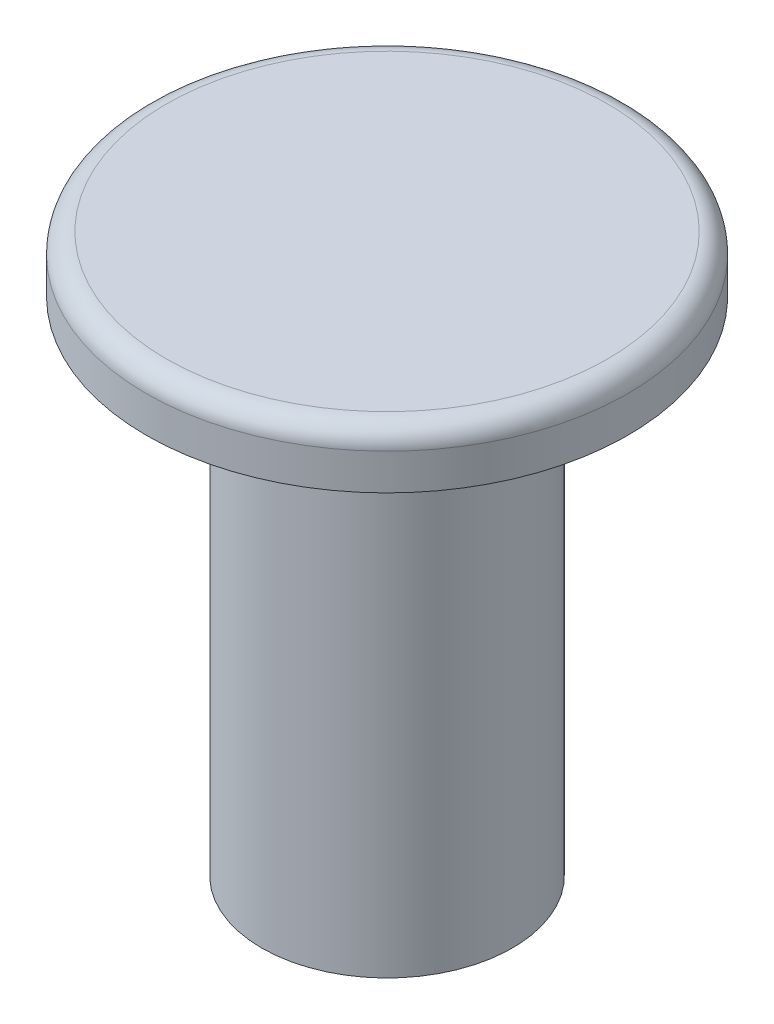
from build123d import *

# Parameters (mm, degrees)
SKETCH1_R           = 2.5
BOSS_EXTRUDE1_DEPTH = 10
SKETCH2_R           = 4.8
BOSS_EXTRUDE2_DEPTH = 1.12
FILLET2_R           = 0.4


with BuildPart() as part:
    # Sketch1 → Boss-Extrude1 (new body)
    with BuildSketch(Plane(origin=(0, 0, 0), x_dir=(1, 0, 0), z_dir=(0, 1, 0))):
        Circle(SKETCH1_R)
    extrude(amount=BOSS_EXTRUDE1_DEPTH)

    # Sketch2 → Boss-Extrude2 (add)
    with BuildSketch(Plane(origin=(0, 10, 0), x_dir=(1, 0, 0), z_dir=(0, 1, 0))):
        Circle(SKETCH2_R)
    extrude(amount=BOSS_EXTRUDE2_DEPTH)

    # Fillet2
    fillet2_edges = [part.edges().sort_by_distance(p)[0] for p in [
        (-4.8, 11.12, 0),
    ]]
    fillet(fillet2_edges, radius=FILLET2_R)


solid = part.part
